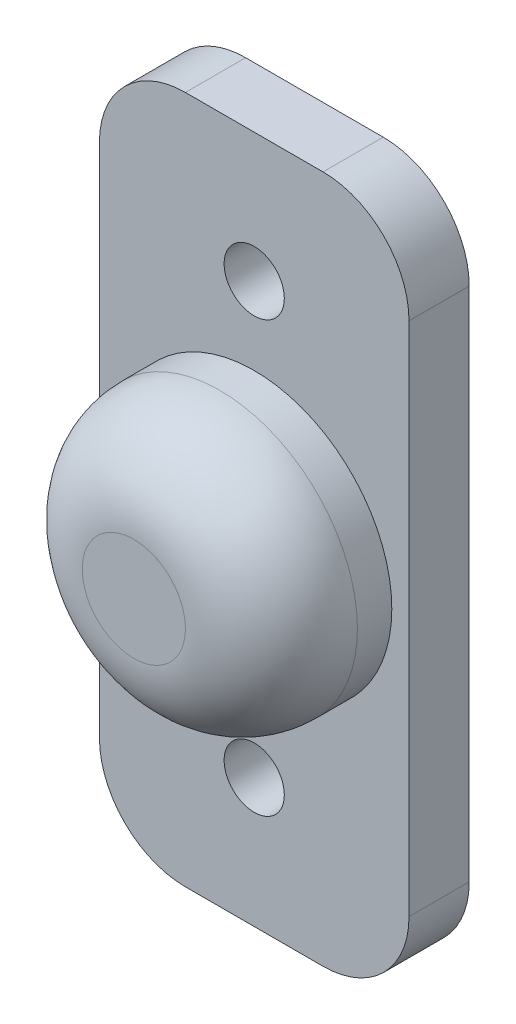
from build123d import *

# Parameters (mm, degrees)
SKETCH1_W           = 18
SKETCH1_H           = 40
SKETCH1_R           = 1.75
BOSS_EXTRUDE1_DEPTH = 3.5
SKETCH2_R           = 8
BOSS_EXTRUDE2_DEPTH = 7
SKETCH3_R           = 5
CUT_EXTRUDE1_DEPTH  = 6.5
FILLET1_R           = 5


with BuildPart() as part:
    # Sketch1 → Boss-Extrude1 (new body)
    with BuildSketch(Plane.XY):
        with Locations((-6.970291657, 8.814124101)):
            Rectangle(SKETCH1_W, SKETCH1_H)
        with Locations((-6.970291657, 21.314124101)):
            Circle(SKETCH1_R, mode=Mode.SUBTRACT)
        with Locations((-6.970291657, -3.685875899)):
            Circle(SKETCH1_R, mode=Mode.SUBTRACT)
    extrude(amount=BOSS_EXTRUDE1_DEPTH)

    # Sketch2 → Boss-Extrude2 (add)
    with BuildSketch(Plane.XY.offset(3.5)):
        with Locations((-6.970291657, 8.814124101)):
            Circle(SKETCH2_R)
    extrude(amount=BOSS_EXTRUDE2_DEPTH)

    # Sketch3 → Cut-Extrude1 (cut)
    with BuildSketch(Plane(origin=(0, 0, 0), x_dir=(-1, 0, 0), z_dir=(0, 0, -1))):
        with Locations((6.970291657, 8.814124101)):
            Circle(SKETCH3_R)
    extrude(amount=-CUT_EXTRUDE1_DEPTH, mode=Mode.SUBTRACT)

    # Fillet1
    fillet1_edges = [part.edges().sort_by_distance(p)[0] for p in [
        (-14.970291657, 8.814124101, 10.5),
        (-15.970291657, 28.814124101, 1.75),
        (2.029708343, 28.814124101, 1.75),
        (2.029708343, -11.185875899, 1.75),
        (-15.970291657, -11.185875899, 1.75),
    ]]
    fillet(fillet1_edges, radius=FILLET1_R)


solid = part.part
